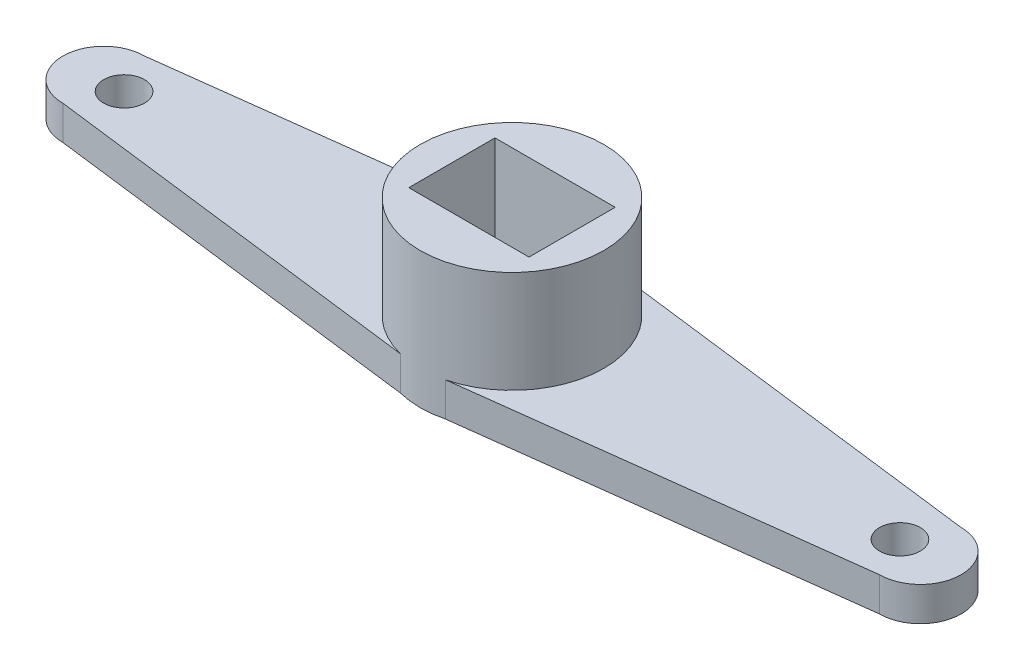
from build123d import *

# Parameters (mm, degrees)
SKETCH1_R           = 4.05
SKETCH1_W           = 5.3
SKETCH1_H           = 3.8
BOSS_EXTRUDE1_DEPTH = 6
BOSS_EXTRUDE2_DEPTH = 1.5
SKETCH3_R           = 0.9
SKETCH3_W           = 5.3
SKETCH3_H           = 3.8
CUT_EXTRUDE1_DEPTH  = 1.5


with BuildPart() as part:
    # Sketch1 → Boss-Extrude1 (new body)
    with BuildSketch(Plane(origin=(0, 0, 0), x_dir=(1, 0, 0), z_dir=(0, 1, 0))):
        with Locations(Location((0, 0, 0), (0, 0, 270))):
            Circle(SKETCH1_R)
        Rectangle(SKETCH1_W, SKETCH1_H, mode=Mode.SUBTRACT)
    extrude(amount=BOSS_EXTRUDE1_DEPTH)

    # Sketch2 → Boss-Extrude2 (add)
    with BuildSketch(Plane(origin=(0, 0, 0), x_dir=(1, 0, 0), z_dir=(0, 1, 0))):
        with BuildLine():
            Line((-18, 1.8), (0, 4.05))
            Line((0, 4.05), (18, 1.8))
            ThreePointArc((18, 1.8), (19.8, 0), (18, -1.8))
            Line((18, -1.8), (0, -4.05))
            Line((0, -4.05), (-18, -1.8))
            ThreePointArc((-18, -1.8), (-19.8, 0), (-18, 1.8))
        make_face()
    extrude(amount=BOSS_EXTRUDE2_DEPTH)

    # Sketch3 → Cut-Extrude1 (cut)
    with BuildSketch(Plane(origin=(0, 0, 0), x_dir=(1, 0, 0), z_dir=(0, 1, 0))):
        with Locations(Location((-17.1, 0, 0), (0, 0, 270))):
            Circle(SKETCH3_R)
        with Locations(Location((17.1, 0, 0), (0, 0, 270))):
            Circle(SKETCH3_R)
        Rectangle(SKETCH3_W, SKETCH3_H)
    extrude(amount=CUT_EXTRUDE1_DEPTH, mode=Mode.SUBTRACT)


solid = part.part
